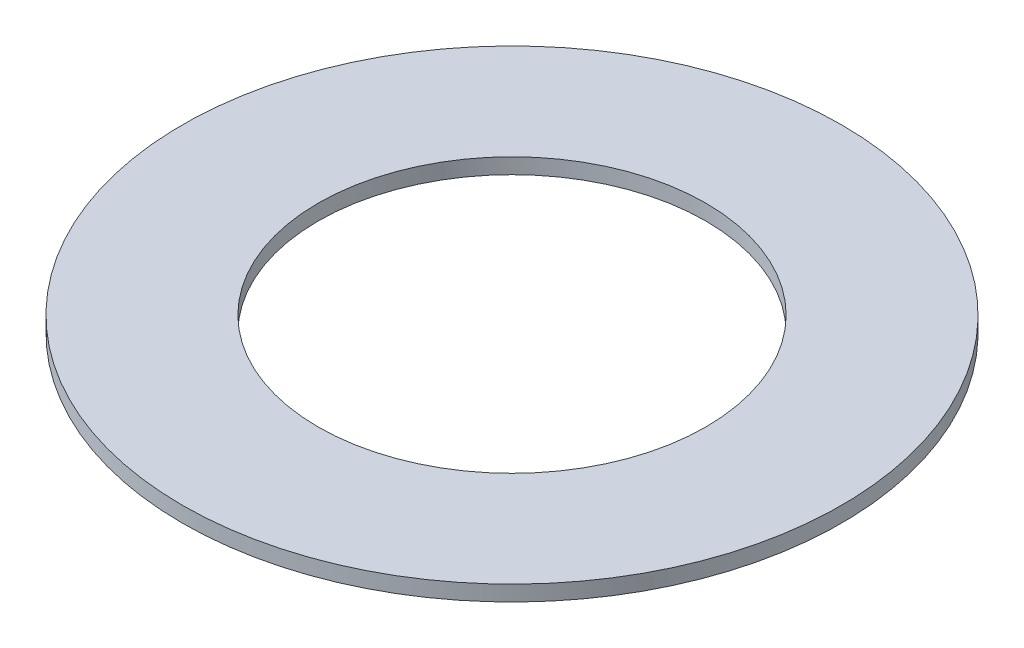
from build123d import *

# Parameters (mm, degrees)
SKETCH1_R           = 10.795
BOSS_EXTRUDE1_DEPTH = 0.508
SKETCH2_R           = 6.35
CUT_EXTRUDE1_DEPTH  = 16.274885073


with BuildPart() as part:
    # Sketch1 → Boss-Extrude1 (new body)
    with BuildSketch(Plane(origin=(0, 0, 0), x_dir=(1, 0, 0), z_dir=(0, 1, 0))):
        with Locations(Location((0, 0, 0), (0, 0, 270))):
            Circle(SKETCH1_R)
    extrude(amount=BOSS_EXTRUDE1_DEPTH)

    # Sketch2 → Cut-Extrude1 (cut, through all)
    with BuildSketch(Plane(origin=(0, 0.508, 0), x_dir=(1, 0, 0), z_dir=(0, 1, 0))):
        with Locations(Location((0, 0, 0), (0, 0, 270))):
            Circle(SKETCH2_R)
    extrude(amount=-CUT_EXTRUDE1_DEPTH, mode=Mode.SUBTRACT)


solid = part.part
